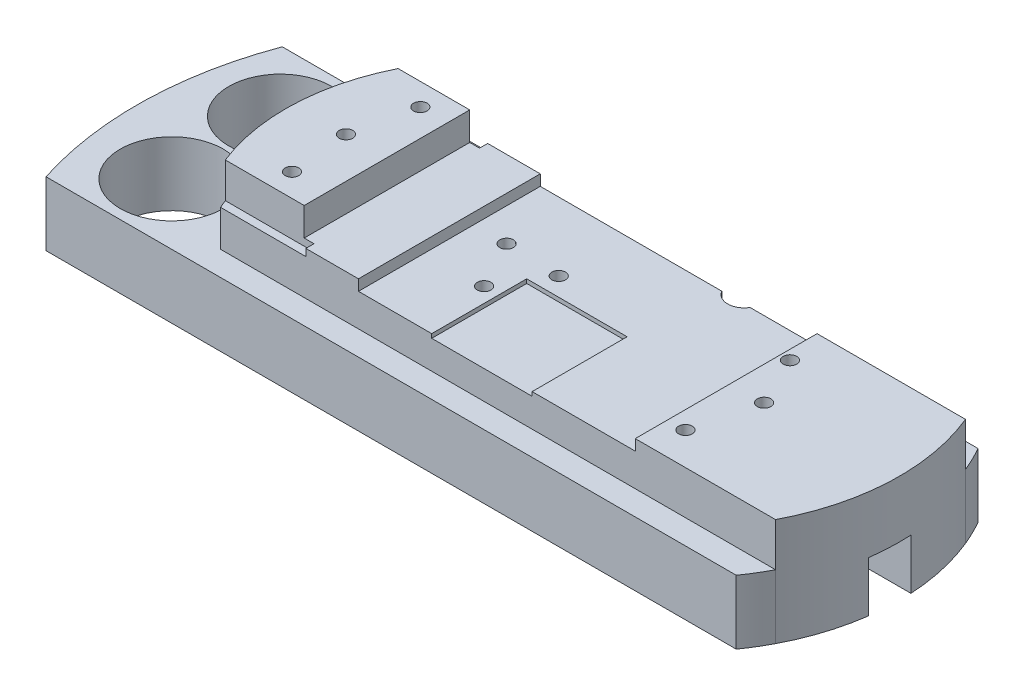
from build123d import *

# Parameters (mm, degrees)
SKETCH1_W           = 220
SKETCH1_H           = 67
BOSS_EXTRUDE1_DEPTH = 50
CUT_EXTRUDE1_DEPTH  = 126.388396592
CUT_EXTRUDE2_DEPTH  = 139.162947276
CUT_EXTRUDE3_START  = -13
SKETCH4_W           = 3.612655346
SKETCH4_H           = 3
CUT_EXTRUDE3_DEPTH  = 13
SKETCH6_R           = 2.5
CUT_EXTRUDE4_DEPTH  = 126.388396592
SKETCH7_W           = 37
SKETCH7_H           = 35
CUT_EXTRUDE5_DEPTH  = 1.5
CUT_EXTRUDE6_DEPTH  = 18.5
BOSS_EXTRUDE2_DEPTH = 23.6
SKETCH9_R           = 2.5
SKETCH9_R_2         = 2.396551724
CUT_EXTRUDE7_DEPTH  = 18.6
CUT_EXTRUDE8_START  = -23.6
SKETCH12_R          = 19
CUT_EXTRUDE8_DEPTH  = 5


with BuildPart() as part:
    # Sketch1 → Boss-Extrude1 (new body)
    with BuildSketch(Plane(origin=(0, 0, 0), x_dir=(1, 0, 0), z_dir=(0, 1, 0))):
        Rectangle(SKETCH1_W, SKETCH1_H)
    extrude(amount=BOSS_EXTRUDE1_DEPTH)

    # Sketch2 → Cut-Extrude1 (cut, through all)
    with BuildSketch(Plane.XZ):
        with BuildLine():
            Line((110, -3.219751644), (110, 33.5))
            Line((110, 33.5), (101, 33.5))
            ThreePointArc((101, 33.5), (107.717186872, 15.683556008), (110, -3.219751644))
        make_face()
        with BuildLine():
            Line((110, -33.5), (110, -3.219751644))
            ThreePointArc((110, -3.219751644), (108.485558513, -18.65423771), (104, -33.5))
            Line((104, -33.5), (110, -33.5))
        make_face()
        with BuildLine():
            ThreePointArc((-100.5, -33.5), (-107.586070475, -15.861694701), (-110, 2.992884395))
            Line((-110, 2.992884395), (-110, -33.5))
            Line((-110, -33.5), (-100.5, -33.5))
        make_face()
        with BuildLine():
            ThreePointArc((-110, 2.992884395), (-108.356964685, 18.588830202), (-103.5, 33.5))
            Line((-103.5, 33.5), (-110, 33.5))
            Line((-110, 33.5), (-110, 2.992884395))
        make_face()
    extrude(amount=-CUT_EXTRUDE1_DEPTH, mode=Mode.SUBTRACT)

    # Sketch3 → Cut-Extrude2 (cut, through all)
    with BuildSketch(Plane(origin=(0, 0, 33.5), x_dir=(-1, 0, 0), z_dir=(0, 0, -1))):
        Polygon((75.7, 50), (75.7, 39.6), (52.7, 39.6), (52.7, 35.6), (-49.3, 35.6), (-49.3, 39.6), (-110, 39.6), (-110, 50), align=None)
    extrude(amount=CUT_EXTRUDE2_DEPTH, mode=Mode.SUBTRACT)

    # Sketch4 → Cut-Extrude3 (cut)
    with BuildSketch(Plane(origin=(0, 50, 0), x_dir=(1, 0, 0), z_dir=(0, 1, 0)).offset(CUT_EXTRUDE3_START)):
        with BuildLine():
            Line((-75.7, 30.5), (-75.7, 33.5))
            Line((-75.7, 33.5), (-100.5, 33.5))
            ThreePointArc((-100.5, 33.5), (-101.310680862, 32.008999469), (-102.087344654, 30.5))
            Line((-102.087344654, 30.5), (-75.7, 30.5))
        make_face()
        with Locations((-73.893672327, 32)):
            Rectangle(SKETCH4_W, SKETCH4_H)
        with BuildLine():
            Line((-75.7, -33.5), (-75.7, -30.5))
            Line((-75.7, -30.5), (-104.761692194, -30.5))
            ThreePointArc((-104.761692194, -30.5), (-104.147155152, -32.006859002), (-103.5, -33.5))
            Line((-103.5, -33.5), (-75.7, -33.5))
        make_face()
        with Locations((-73.893672327, -32)):
            Rectangle(SKETCH4_W, SKETCH4_H)
    extrude(amount=CUT_EXTRUDE3_DEPTH, mode=Mode.SUBTRACT)

    # Sketch6 → Cut-Extrude4 (cut, through all)
    with BuildSketch(Plane.XZ):
        with Locations(Location((-40.6, -9, 0), (0, 0, 270))):
            Circle(SKETCH6_R)
        with Locations(Location((-20.7, -8.3, 0), (0, 0, 270))):
            Circle(SKETCH6_R)
        with Locations(Location((-31.2, 8.7, 0), (0, 0, 270))):
            Circle(SKETCH6_R)
        with Locations(Location((-88.7, 22, 0), (0, 0, 270))):
            Circle(SKETCH6_R)
        with Locations(Location((-90.7, 0.1, 0), (0, 0, 270))):
            Circle(SKETCH6_R)
        with Locations(Location((-85.7, -22.3, 0), (0, 0, 270))):
            Circle(SKETCH6_R)
        with Locations(Location((52.8, -20, 0), (0, 0, 270))):
            Circle(SKETCH6_R)
        with Locations(Location((61.6, -1.7, 0), (0, 0, 270))):
            Circle(SKETCH6_R)
        with Locations(Location((55.8, 21.5, 0), (0, 0, 270))):
            Circle(SKETCH6_R)
    extrude(amount=-CUT_EXTRUDE4_DEPTH, mode=Mode.SUBTRACT)

    # Sketch7 → Cut-Extrude5 (cut)
    with BuildSketch(Plane(origin=(0, 35.6, 0), x_dir=(1, 0, 0), z_dir=(0, 1, 0))):
        with Locations((-7.2, -16)):
            Rectangle(SKETCH7_W, SKETCH7_H)
    extrude(amount=-CUT_EXTRUDE5_DEPTH, mode=Mode.SUBTRACT)

    # Sketch8 → Cut-Extrude6 (cut)
    with BuildSketch(Plane(origin=(0, 50, 0), x_dir=(1, 0, 0), z_dir=(0, 1, 0))):
        with BuildLine():
            Line((24.596152423, 33.5), (19.4, 33.5))
            Line((19.4, 33.5), (19.4, 30.5))
            ThreePointArc((19.4, 30.5), (22.4, 31.303847577), (24.596152423, 33.5))
        make_face()
        with BuildLine():
            Line((19.4, 33.5), (14.203847577, 33.5))
            ThreePointArc((14.203847577, 33.5), (16.4, 31.303847577), (19.4, 30.5))
            Line((19.4, 30.5), (19.4, 33.5))
        make_face()
    extrude(amount=-CUT_EXTRUDE6_DEPTH, mode=Mode.SUBTRACT)


with BuildPart() as body_2:
    # Sketch10 → Boss-Extrude2 (new body)
    with BuildSketch(Plane.XZ):
        with BuildLine():
            Line((-34.333135379, 42.5), (-98.722865603, 42.5))
            ThreePointArc((-98.722865603, 42.5), (-101.264774078, 38.081392432), (-103.5, 33.5))
            Line((-103.5, 33.5), (-39.81557342, 33.5))
            ThreePointArc((-39.81557342, 33.5), (-37.223820086, 38.091048485), (-34.333135379, 42.5))
        make_face()
        with BuildLine():
            Line((28.405035228, 42.5), (-34.333135379, 42.5))
            ThreePointArc((-34.333135379, 42.5), (-37.223820086, 38.091048485), (-39.81557342, 33.5))
            Line((-39.81557342, 33.5), (33.182169625, 33.5))
            ThreePointArc((33.182169625, 33.5), (30.946943703, 38.081392432), (28.405035228, 42.5))
        make_face()
        with BuildLine():
            Line((88.525744823, 42.5), (28.405035228, 42.5))
            ThreePointArc((28.405035228, 42.5), (30.946943703, 38.081392432), (33.182169625, 33.5))
            Line((33.182169625, 33.5), (91.047357251, 33.5))
            ThreePointArc((91.047357251, 33.5), (89.867560129, 38.022697059), (88.525744823, 42.5))
        make_face()
        with BuildLine():
            Line((95.517561959, 42.5), (88.525744823, 42.5))
            ThreePointArc((88.525744823, 42.5), (89.867560129, 38.022697059), (91.047357251, 33.5))
            Line((91.047357251, 33.5), (101, 33.5))
            ThreePointArc((101, 33.5), (98.408246666, 38.091048485), (95.517561959, 42.5))
        make_face()
        with BuildLine():
            Line((86.451548074, -42.5), (99.604231658, -42.5))
            ThreePointArc((99.604231658, -42.5), (101.944159442, -38.069376757), (104, -33.5))
            Line((104, -33.5), (89.448374703, -33.5))
            ThreePointArc((89.448374703, -33.5), (88.032178207, -38.027376617), (86.451548074, -42.5))
        make_face()
        with BuildLine():
            Line((89.448374703, -33.5), (30.182169625, -33.5))
            ThreePointArc((30.182169625, -33.5), (27.387289581, -38.106510308), (24.268228824, -42.5))
            Line((24.268228824, -42.5), (86.451548074, -42.5))
            ThreePointArc((86.451548074, -42.5), (88.032178207, -38.027376617), (89.448374703, -33.5))
        make_face()
        with BuildLine():
            Line((-42.81557342, -33.5), (-100.5, -33.5))
            ThreePointArc((-100.5, -33.5), (-97.705119956, -38.106510308), (-94.586059199, -42.5))
            Line((-94.586059199, -42.5), (-38.419805078, -42.5))
            ThreePointArc((-38.419805078, -42.5), (-40.759732861, -38.069376757), (-42.81557342, -33.5))
        make_face()
        with BuildLine():
            Line((30.182169625, -33.5), (-42.81557342, -33.5))
            ThreePointArc((-42.81557342, -33.5), (-40.759732861, -38.069376757), (-38.419805078, -42.5))
            Line((-38.419805078, -42.5), (24.268228824, -42.5))
            ThreePointArc((24.268228824, -42.5), (27.387289581, -38.106510308), (30.182169625, -33.5))
        make_face()
        with BuildLine():
            ThreePointArc((-103.5, 33.5), (-101.264774078, 38.081392432), (-98.722865603, 42.5))
            Line((-98.722865603, 42.5), (-158.843575198, 42.5))
            ThreePointArc((-158.843575198, 42.5), (-164.961358829, -0.174595682), (-156.769378449, -42.5))
            Line((-156.769378449, -42.5), (-94.586059199, -42.5))
            ThreePointArc((-94.586059199, -42.5), (-97.705119956, -38.106510308), (-100.5, -33.5))
            ThreePointArc((-100.5, -33.5), (-109.925088146, -0.354854693), (-103.5, 33.5))
        make_face()
    extrude(amount=-BOSS_EXTRUDE2_DEPTH)


with BuildPart() as cut_extrude7_tool:
    # Sketch9 → Cut-Extrude7 (new body)
    # profile 1 of 17: a face of its own
    with BuildSketch(Plane.XZ):
        with BuildLine():
            ThreePointArc((-128.248186972, 2.240128918), (-126.585767055, 2.964722369), (-125, 3.844505579))
            Line((-125, 3.844505579), (-125, 28.5))
            Line((-125, 28.5), (-118.007354532, 28.5))
            ThreePointArc((-118.007354532, 28.5), (-118.317527246, 29.093684777), (-118.648433766, 29.67606747))
            ThreePointArc((-118.648433766, 29.67606747), (-152.933884531, 26.275012798), (-128.248186972, 2.240128918))
        make_face()
    # profile 2 of 17: a face of its own
    with BuildSketch(Plane.XZ):
        with BuildLine():
            Line((-125, 28.5), (-125, 3.844505579))
            ThreePointArc((-125, 3.844505579), (-118.401807327, 10.753378996), (-116, 20))
            ThreePointArc((-116, 20), (-116.508647103, 24.366906005), (-118.007354532, 28.5))
            Line((-118.007354532, 28.5), (-125, 28.5))
        make_face()
    # profile 3 of 17: a face of its own
    with BuildSketch(Plane.XZ):
        with BuildLine():
            Line((-125, -3.844505579), (-125, -28.5))
            Line((-125, -28.5), (-118.007354532, -28.5))
            ThreePointArc((-118.007354532, -28.5), (-116.508647103, -24.366906005), (-116, -20))
            ThreePointArc((-116, -20), (-118.401807327, -10.753378996), (-125, -3.844505579))
        make_face()
    # profile 4 of 17: a face of its own
    with BuildSketch(Plane.XZ):
        with BuildLine():
            Line((-118.007354532, -28.5), (-125, -28.5))
            Line((-125, -28.5), (-125, -3.844505579))
            ThreePointArc((-125, -3.844505579), (-126.58576708, -2.964722357), (-128.248187023, -2.240128899))
            ThreePointArc((-128.248187023, -2.240128899), (-152.933884587, -26.275012638), (-118.648433966, -29.676067808))
            ThreePointArc((-118.648433966, -29.676067808), (-118.31752734, -29.093684949), (-118.007354532, -28.5))
        make_face()
    # profile 5 of 17: a face of its own
    with BuildSketch(Plane.XZ):
        with BuildLine():
            ThreePointArc((-116, -20), (-116.508647103, -24.366906005), (-118.007354532, -28.5))
            Line((-118.007354532, -28.5), (-116.585940529, -28.5))
            Line((-116.585940529, -28.5), (-103.051375803, -28.5))
            ThreePointArc((-103.051375803, -28.5), (-109.929952581, -0.24438961), (-105.519238022, 28.5))
            Line((-105.519238022, 28.5), (-116.585940529, 28.5))
            Line((-116.585940529, 28.5), (-118.007354532, 28.5))
            ThreePointArc((-118.007354532, 28.5), (-116.508647103, 24.366906005), (-116, 20))
            ThreePointArc((-116, 20), (-118.401807327, 10.753378996), (-125, 3.844505579))
            Line((-125, 3.844505579), (-125, 0))
            Line((-125, 0), (-125, -3.844505579))
            ThreePointArc((-125, -3.844505579), (-118.401807327, -10.753378996), (-116, -20))
        make_face()
    # profile 6 of 17: a face of its own
    with BuildSketch(Plane.XZ):
        with BuildLine():
            ThreePointArc((-105.519238022, 28.5), (-109.929952581, -0.24438961), (-103.051375803, -28.5))
            Line((-103.051375803, -28.5), (-2.396551708, -28.5))
            ThreePointArc((-2.396551708, -28.5), (-4.091169705, -24.408830306), (0, -26.103448276))
            Line((0, -26.103448276), (0, -9.896551726))
            Line((0, -9.896551726), (0, -7.5))
            Line((0, -7.5), (0, 7.5))
            Line((0, 7.5), (0, 9.896551721))
            Line((0, 9.896551721), (0, 26.103448276))
            ThreePointArc((0, 26.103448276), (-4.0911697, 24.4088303), (-2.396551724, 28.5))
            Line((-2.396551724, 28.5), (-105.519238022, 28.5))
        make_face()
        with Locations(Location((-85.7, -22.3, 0), (0, 0, 270))):
            Circle(SKETCH9_R, mode=Mode.SUBTRACT)
        with Locations((-40.6, -9)):
            Circle(SKETCH9_R, mode=Mode.SUBTRACT)
        with Locations((-20.7, -8.3)):
            Circle(SKETCH9_R, mode=Mode.SUBTRACT)
        with Locations(Location((-90.7, 0.1, 0), (0, 0, 270))):
            Circle(SKETCH9_R, mode=Mode.SUBTRACT)
        with Locations((-31.2, 8.7)):
            Circle(SKETCH9_R, mode=Mode.SUBTRACT)
        with Locations(Location((-88.7, 22, 0), (0, 0, 270))):
            Circle(SKETCH9_R, mode=Mode.SUBTRACT)
    # profile 7 of 17: a face of its own
    with BuildSketch(Plane.XZ):
        with BuildLine():
            Line((0, 7.5), (0, -7.5))
            Line((0, -7.5), (2.396551724, -7.5))
            Line((2.396551724, -7.5), (109.884558849, -7.5))
            ThreePointArc((109.884558849, -7.5), (109.971134466, -5.360654062), (110, -3.219751644))
            ThreePointArc((110, -3.219751644), (109.818069102, 2.15243237), (109.273110049, 7.5))
            Line((109.273110049, 7.5), (2.396551724, 7.5))
            Line((2.396551724, 7.5), (0, 7.5))
        make_face()
        with Locations((61.6, -1.7)):
            Circle(SKETCH9_R, mode=Mode.SUBTRACT)
    # profile 8 of 17: a face of its own
    with BuildSketch(Plane.XZ):
        with Locations((-2.396551724, -26.103448276)):
            Circle(SKETCH9_R_2)
    # profile 9 of 17: a face of its own
    with BuildSketch(Plane.XZ):
        with Locations((-2.396551724, 26.103448276)):
            Circle(SKETCH9_R_2)
    # profile 10 of 17: a face of its own
    with BuildSketch(Plane.XZ):
        with BuildLine():
            ThreePointArc((2.396551724, 7.5), (0.70193375, 8.201933747), (0, 9.896551721))
            Line((0, 9.896551721), (0, 7.5))
            Line((0, 7.5), (2.396551724, 7.5))
        make_face()
    # profile 11 of 17: a face of its own
    with BuildSketch(Plane.XZ):
        with BuildLine():
            Line((0, -7.5), (0, -9.896551726))
            ThreePointArc((0, -9.896551726), (0.701933748, -8.201933749), (2.396551724, -7.5))
            Line((2.396551724, -7.5), (0, -7.5))
        make_face()
    # profile 12 of 17: a face of its own
    with BuildSketch(Plane.XZ):
        with BuildLine():
            Line((-125, -3.844505579), (-125, -28.5))
            Line((-125, -28.5), (-118.007354532, -28.5))
            ThreePointArc((-118.007354532, -28.5), (-116.508647103, -24.366906005), (-116, -20))
            ThreePointArc((-116, -20), (-118.401807327, -10.753378996), (-125, -3.844505579))
        make_face()
    # profile 13 of 17: a face of its own
    with BuildSketch(Plane.XZ):
        with BuildLine():
            Line((-118.007354532, -28.5), (-125, -28.5))
            Line((-125, -28.5), (-125, -3.844505579))
            ThreePointArc((-125, -3.844505579), (-126.58576708, -2.964722357), (-128.248187023, -2.240128899))
            ThreePointArc((-128.248187023, -2.240128899), (-152.933884587, -26.275012638), (-118.648433966, -29.676067808))
            ThreePointArc((-118.648433966, -29.676067808), (-118.31752734, -29.093684949), (-118.007354532, -28.5))
        make_face()
    # profile 14 of 17: a face of its own
    with BuildSketch(Plane.XZ):
        with BuildLine():
            ThreePointArc((-128.248186972, 2.240128918), (-126.585767055, 2.964722369), (-125, 3.844505579))
            Line((-125, 3.844505579), (-125, 28.5))
            Line((-125, 28.5), (-118.007354532, 28.5))
            ThreePointArc((-118.007354532, 28.5), (-118.317527246, 29.093684777), (-118.648433766, 29.67606747))
            ThreePointArc((-118.648433766, 29.67606747), (-152.933884531, 26.275012798), (-128.248186972, 2.240128918))
        make_face()
    # profile 15 of 17: a face of its own
    with BuildSketch(Plane.XZ):
        with BuildLine():
            Line((-125, 28.5), (-125, 3.844505579))
            ThreePointArc((-125, 3.844505579), (-118.401807327, 10.753378996), (-116, 20))
            ThreePointArc((-116, 20), (-116.508647103, 24.366906005), (-118.007354532, 28.5))
            Line((-118.007354532, 28.5), (-125, 28.5))
        make_face()
    # profile 16 of 17: a face of its own
    with BuildSketch(Plane.XZ):
        with BuildLine():
            ThreePointArc((-128.248186972, 2.240128918), (-126.035950342, 1.972872029), (-125, 0))
            Line((-125, 0), (-125, 3.844505579))
            ThreePointArc((-125, 3.844505579), (-126.585767055, 2.964722369), (-128.248186972, 2.240128918))
        make_face()
    # profile 17 of 17: a face of its own
    with BuildSketch(Plane.XZ):
        with BuildLine():
            ThreePointArc((-128.248187023, -2.240128899), (-126.58576708, -2.964722357), (-125, -3.844505579))
            Line((-125, -3.844505579), (-125, 0))
            ThreePointArc((-125, 0), (-126.035950364, -1.972872045), (-128.248187023, -2.240128899))
        make_face()
    extrude(amount=-CUT_EXTRUDE7_DEPTH)


with BuildPart() as part_1:
    add(part.part)

    # Cut-Extrude7: cut by cut_extrude7_tool
    add(cut_extrude7_tool.part, mode=Mode.SUBTRACT)


with BuildPart() as body_2_1:
    add(body_2.part)

    # Cut-Extrude7: cut by cut_extrude7_tool
    add(cut_extrude7_tool.part, mode=Mode.SUBTRACT)

    # Sketch12 → Cut-Extrude8 (cut)
    with BuildSketch(Plane.XZ.offset(CUT_EXTRUDE8_START)):
        with Locations(Location((-135, -20, 0), (0, 0, 333.425030481))):
            Circle(SKETCH12_R)
        with Locations(Location((-135, 20, 0), (0, 0, 290.815422625))):
            Circle(SKETCH12_R)
    extrude(amount=CUT_EXTRUDE8_DEPTH, mode=Mode.SUBTRACT)


solid = Compound([part_1.part, body_2_1.part])
